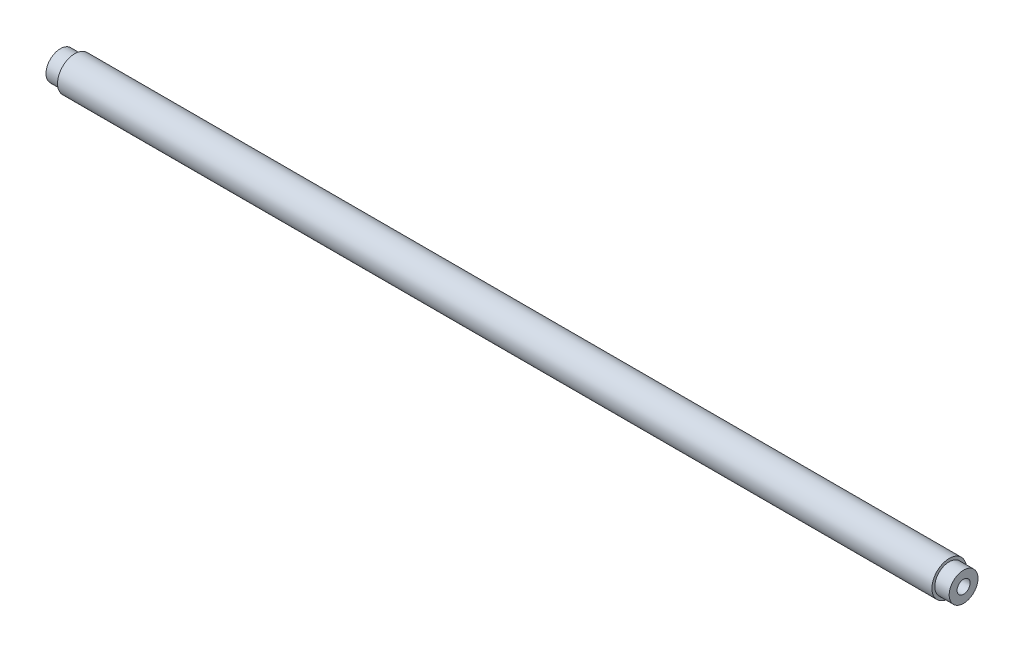
from build123d import *


with BuildPart() as part:
    # Çizim1 → Döndür2 (revolve)
    with BuildSketch(Plane.XY, mode=Mode.PRIVATE) as d_nd_r2_sk:
        Polygon((-235, 0), (235, 0), (235, 7.5), (227.5, 7.5), (227.5, 9), (-227.5, 9), (-227.5, 7.5), (-235, 7.5), align=None)
    revolve(d_nd_r2_sk.sketch.rotate(Axis((-235, 0, 0), (1, 0, 0)), 180), axis=Axis((-235, 0, 0), (1, 0, 0)))

    # Çizim4 → M8 Dişli Delik3 (revolve, cut)
    with BuildSketch(Plane(origin=(-235, 0, 0), x_dir=(0, 0, 1), z_dir=(0, 1, 0))):
        Polygon((0, 0), (0, 24.292926105), (3.4, 22.25), (3.4, 0), align=None)
    m8_di_li_delik3 = revolve(axis=Axis((-241.35, 0, 0), (1, 0, 0)), mode=Mode.SUBTRACT)

    # Aynalama1: M8 Dişli Delik3 across plane
    add(m8_di_li_delik3.mirror(Plane(origin=(0, 0, 0), x_dir=(0, 0, 1), z_dir=(1, 0, 0))), mode=Mode.SUBTRACT)


solid = part.part
